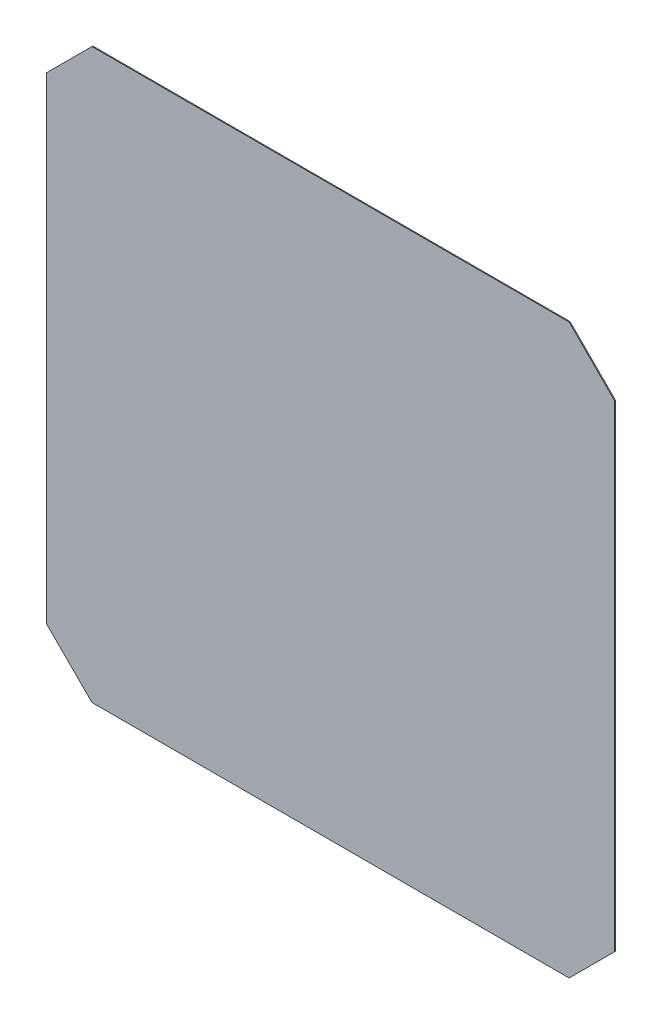
from build123d import *

# Parameters (mm, degrees)
EXTRUDE_1_DEPTH = 0.2


with BuildPart() as part:
    # 草图1 → 凸台-拉伸1 (new body)
    with BuildSketch(Plane.XY):
        Polygon((52.5, 62.5), (62.5, 52.5), (62.5, -52.5), (52.5, -62.5), (-52.5, -62.5), (-62.5, -52.5), (-62.5, 52.5), (-52.5, 62.5), align=None)
    extrude(amount=EXTRUDE_1_DEPTH)


solid = part.part
